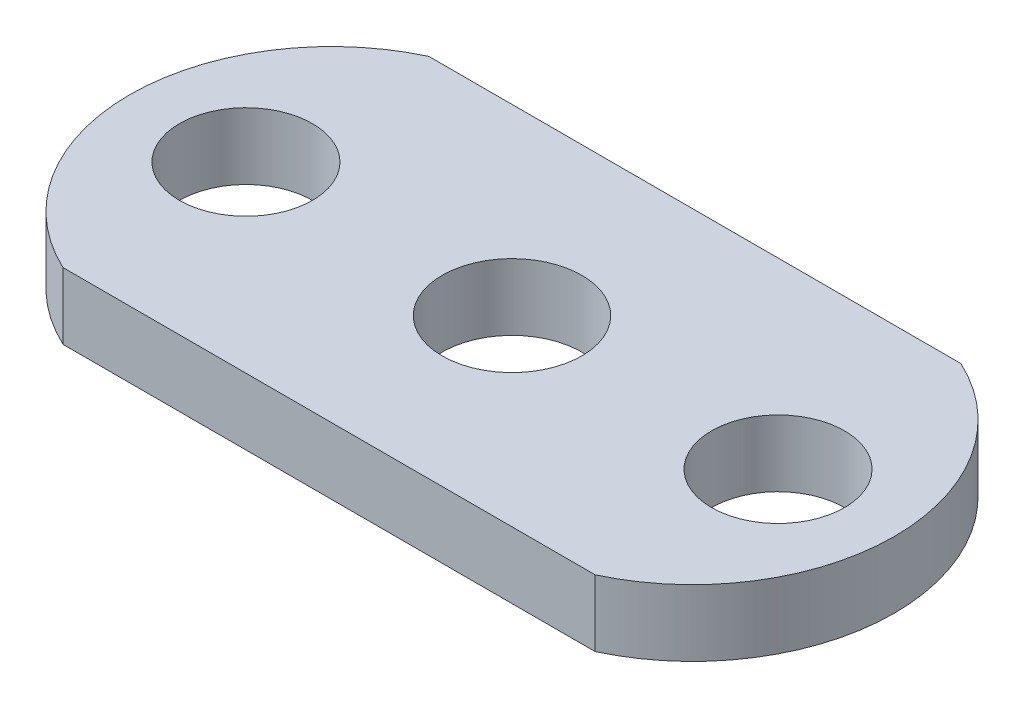
from build123d import *

# Parameters (mm, degrees)
CROQUIS1_R              = 2
CROQUIS1_R_2            = 2.1
SALIENTE_EXTRUIR1_DEPTH = 2


with BuildPart() as part:
    # Croquis1 → Saliente-Extruir1 (new body)
    with BuildSketch(Plane(origin=(0, 0, 0), x_dir=(1, 0, 0), z_dir=(0, 1, 0))):
        with BuildLine():
            Line((-8, 5.5), (8, 5.5))
            ThreePointArc((8, 5.5), (11.5, 0), (8, -5.5))
            Line((8, -5.5), (-8, -5.5))
            ThreePointArc((-8, -5.5), (-11.5, 0), (-8, 5.5))
        make_face()
        with Locations(Location((8, 0, 0), (0, 0, 270))):
            Circle(CROQUIS1_R, mode=Mode.SUBTRACT)
        with Locations(Location((0, 0, 0), (0, 0, 270))):
            Circle(CROQUIS1_R_2, mode=Mode.SUBTRACT)
        with Locations(Location((-8, 0, 0), (0, 0, 270))):
            Circle(CROQUIS1_R, mode=Mode.SUBTRACT)
    extrude(amount=SALIENTE_EXTRUIR1_DEPTH)


solid = part.part
